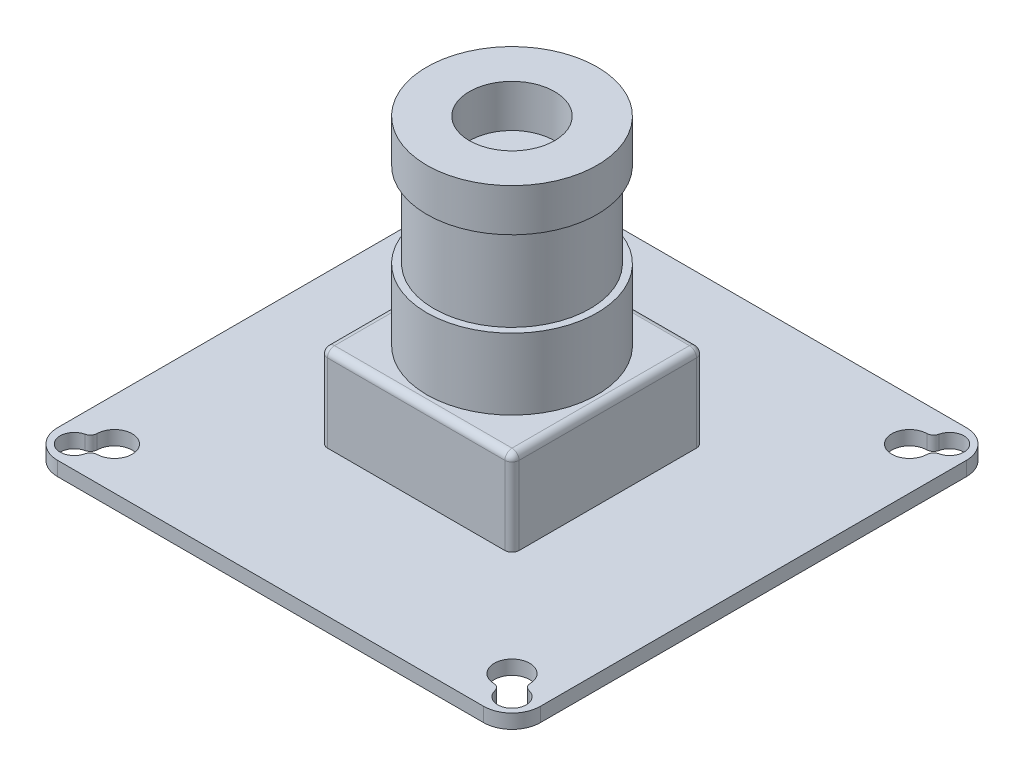
from build123d import *

# Parameters (mm, degrees)
SKETCH2_W           = 34
SKETCH2_H           = 34
BOSS_EXTRUDE2_DEPTH = 1
FILLET1_R           = 2
SKETCH3_W           = 13.5
SKETCH3_H           = 13.5
BOSS_EXTRUDE3_DEPTH = 6
SKETCH4_R           = 6
BOSS_EXTRUDE4_DEPTH = 5
FILLET2_R           = 0.5
SKETCH5_R           = 5.5
BOSS_EXTRUDE5_DEPTH = 6
SKETCH6_R           = 6
SKETCH6_R_2         = 3
BOSS_EXTRUDE6_DEPTH = 3
SKETCH7_R           = 1
SKETCH7_R_2         = 1.25
CUT_EXTRUDE1_DEPTH  = 32.272991542
FILLET3_R           = 0.5


with BuildPart() as part:
    # Sketch2 → Boss-Extrude2 (new body)
    with BuildSketch(Plane(origin=(0, 0, 0), x_dir=(1, 0, 0), z_dir=(0, 1, 0))):
        Rectangle(SKETCH2_W, SKETCH2_H)
    extrude(amount=BOSS_EXTRUDE2_DEPTH)

    # Fillet1
    fillet1_edges = [part.edges().sort_by_distance(p)[0] for p in [
        (17, 0.5, 17),
        (-17, 0.5, 17),
        (-17, 0.5, -17),
        (17, 0.5, -17),
    ]]
    fillet(fillet1_edges, radius=FILLET1_R)

    # Sketch3 → Boss-Extrude3 (add)
    with BuildSketch(Plane(origin=(0, 1, 0), x_dir=(1, 0, 0), z_dir=(0, 1, 0))):
        Rectangle(SKETCH3_W, SKETCH3_H)
    extrude(amount=BOSS_EXTRUDE3_DEPTH)

    # Sketch4 → Boss-Extrude4 (add)
    with BuildSketch(Plane(origin=(0, 7, 0), x_dir=(1, 0, 0), z_dir=(0, 1, 0))):
        with Locations(Location((0, 0, 0), (0, 0, 270))):
            Circle(SKETCH4_R)
    extrude(amount=BOSS_EXTRUDE4_DEPTH)

    # Fillet2
    fillet2_edges = [part.edges().sort_by_distance(p)[0] for p in [
        (6.75, 4, 6.75),
        (6.75, 4, -6.75),
        (-6.75, 4, -6.75),
        (-6.75, 4, 6.75),
        (6.75, 7, 0),
        (0, 7, -6.75),
        (-6.75, 7, 0),
        (0, 7, 6.75),
    ]]
    fillet(fillet2_edges, radius=FILLET2_R)

    # Sketch5 → Boss-Extrude5 (add)
    with BuildSketch(Plane(origin=(0, 12, 0), x_dir=(1, 0, 0), z_dir=(0, 1, 0))):
        with Locations(Location((0, 0, 0), (0, 0, 270))):
            Circle(SKETCH5_R)
    extrude(amount=BOSS_EXTRUDE5_DEPTH)

    # Sketch6 → Boss-Extrude6 (add)
    with BuildSketch(Plane(origin=(0, 18, 0), x_dir=(1, 0, 0), z_dir=(0, 1, 0))):
        with Locations(Location((0, 0, 0), (0, 0, 270))):
            Circle(SKETCH6_R)
        with Locations(Location((0, 0, 0), (0, 0, 270))):
            Circle(SKETCH6_R_2, mode=Mode.SUBTRACT)
    extrude(amount=BOSS_EXTRUDE6_DEPTH)

    # Sketch7 → Cut-Extrude1 (cut, through all)
    with BuildSketch(Plane(origin=(0, 1, 0), x_dir=(1, 0, 0), z_dir=(0, 1, 0))):
        with Locations((-15.414213562, -15.414213562)):
            Circle(SKETCH7_R)
        with Locations((-14, -14)):
            Circle(SKETCH7_R_2)
        with Locations((15.414213562, -15.414213562)):
            Circle(SKETCH7_R)
        with Locations((14, -14)):
            Circle(SKETCH7_R_2)
        with Locations((15.414213562, 15.414213562)):
            Circle(SKETCH7_R)
        with Locations((14, 14)):
            Circle(SKETCH7_R_2)
        with Locations((-15.414213562, 15.414213562)):
            Circle(SKETCH7_R)
        with Locations((-14, 14)):
            Circle(SKETCH7_R_2)
    extrude(amount=-CUT_EXTRUDE1_DEPTH, mode=Mode.SUBTRACT)

    # Fillet3
    fillet3_edges = [part.edges().sort_by_distance(p)[0] for p in [
        (-14.444967533, 0.5, -15.168119812),
        (-15.168119812, 0.5, -14.444967533),
        (15.168119812, 0.5, -14.444967533),
        (14.444967533, 0.5, -15.168119812),
        (14.444967533, 0.5, 15.168119812),
        (15.168119812, 0.5, 14.444967533),
        (-15.168119812, 0.5, 14.444967533),
        (-14.444967533, 0.5, 15.168119812),
    ]]
    fillet(fillet3_edges, radius=FILLET3_R)


solid = part.part
